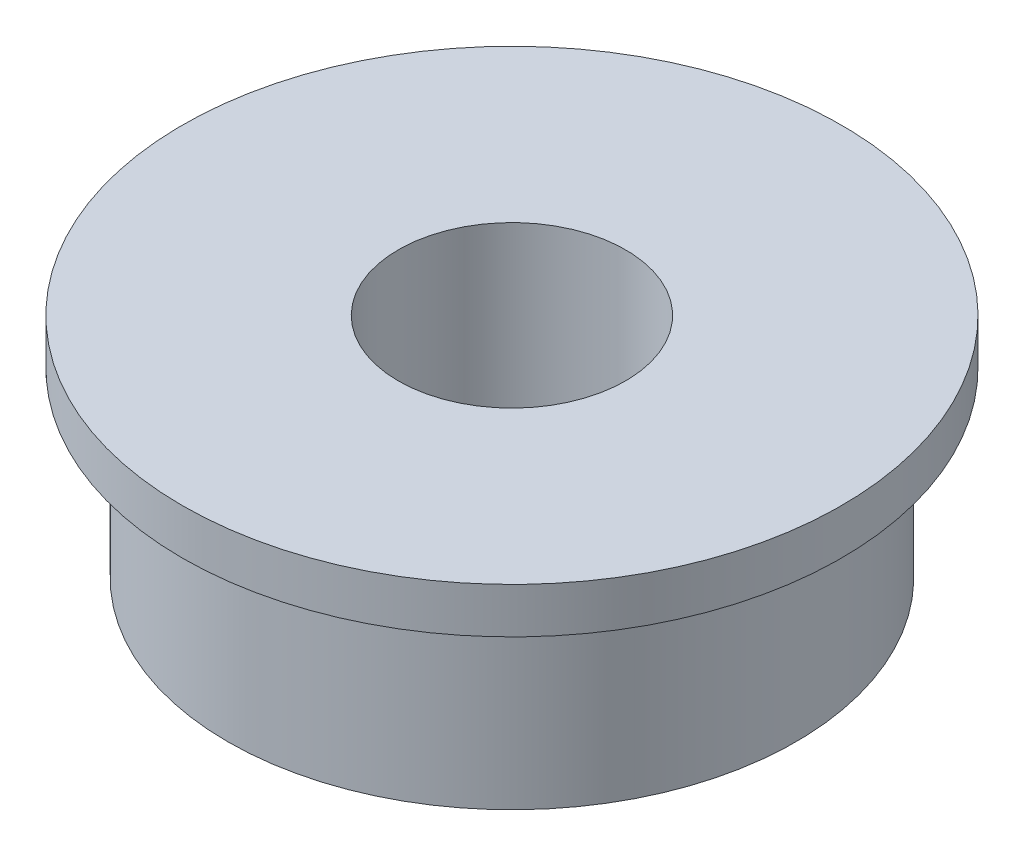
from build123d import *

# Parameters (mm, degrees)
SKETCH_1_R      = 5
SKETCH_1_R_2    = 2
EXTRUDE_1_DEPTH = 3.2
SKETCH_2_R      = 5.8
SKETCH_2_R_2    = 2
EXTRUDE_2_DEPTH = 0.8


with BuildPart() as part:
    # 草图1 → 凸台-拉伸1 (new body)
    with BuildSketch(Plane(origin=(0, 0, 0), x_dir=(1, 0, 0), z_dir=(0, 1, 0))):
        with Locations(Location((0, 0, 0), (0, 0, 270))):
            Circle(SKETCH_1_R)
        with Locations(Location((0, 0, 0), (0, 0, 270))):
            Circle(SKETCH_1_R_2, mode=Mode.SUBTRACT)
    extrude(amount=EXTRUDE_1_DEPTH)

    # 草图2 → 凸台-拉伸2 (add)
    with BuildSketch(Plane(origin=(0, 3.2, 0), x_dir=(1, 0, 0), z_dir=(0, 1, 0))):
        with Locations(Location((0, 0, 0), (0, 0, 270))):
            Circle(SKETCH_2_R)
        with Locations(Location((0, 0, 0), (0, 0, 270))):
            Circle(SKETCH_2_R_2, mode=Mode.SUBTRACT)
    extrude(amount=EXTRUDE_2_DEPTH)


solid = part.part
